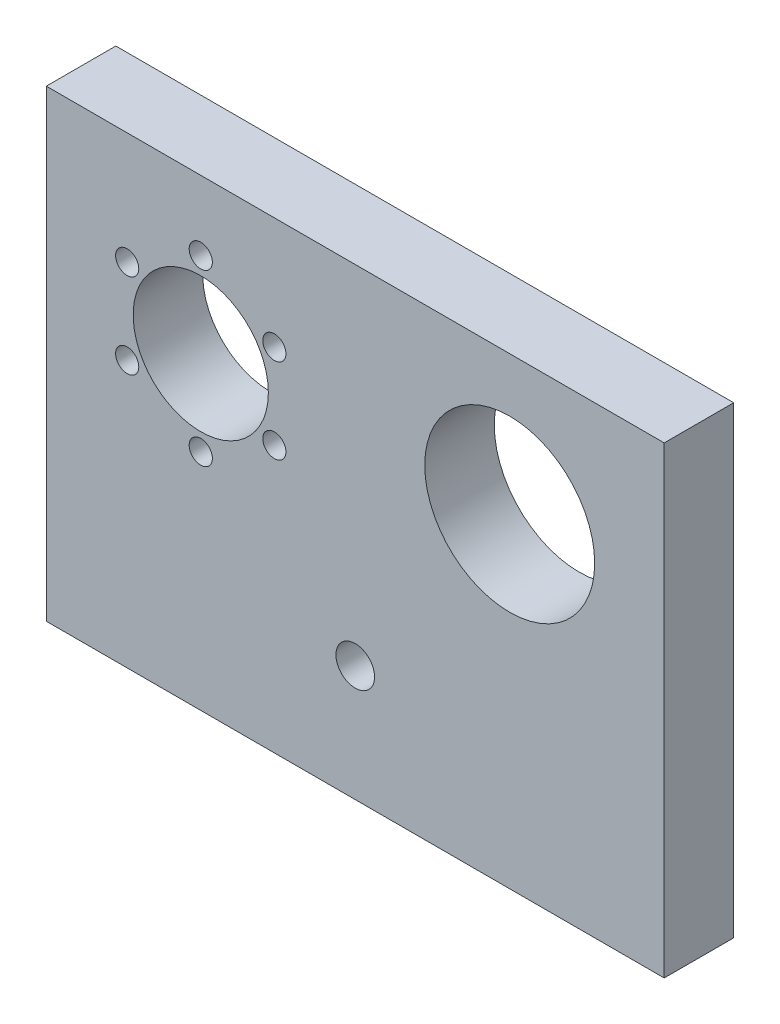
from build123d import *

# Parameters (mm, degrees)
ESQUISSE1_W             = 80
ESQUISSE1_H             = 60
BOSS_EXTRU_1_DEPTH      = 9
ESQUISSE2_R             = 11
ESQUISSE2_R_2           = 8.75
ESQUISSE2_R_3           = 1.5
ENL_V_MAT_EXTRU_1_DEPTH = 101.40418318
ESQUISSE3_R             = 2.5
ENL_V_MAT_EXTRU_2_DEPTH = 101.40418318


with BuildPart() as part:
    # Esquisse1 → Boss.-Extru.1 (new body)
    with BuildSketch(Plane.XY):
        with Locations((40, 30)):
            Rectangle(ESQUISSE1_W, ESQUISSE1_H)
    extrude(amount=BOSS_EXTRU_1_DEPTH)

    # Esquisse2 → Enlèv. mat.-Extru.1 (cut, through all)
    with BuildSketch(Plane.XY.offset(9)):
        with Locations((60, 42)):
            Circle(ESQUISSE2_R)
        with Locations((20, 40)):
            Circle(ESQUISSE2_R_2)
        with Locations((20, 51)):
            Circle(ESQUISSE2_R_3)
        with Locations((29.526279442, 45.5)):
            Circle(ESQUISSE2_R_3)
        with Locations((29.526279442, 34.5)):
            Circle(ESQUISSE2_R_3)
        with Locations((20, 29)):
            Circle(ESQUISSE2_R_3)
        with Locations((10.473720558, 34.5)):
            Circle(ESQUISSE2_R_3)
        with Locations((10.473720558, 45.5)):
            Circle(ESQUISSE2_R_3)
    extrude(amount=-ENL_V_MAT_EXTRU_1_DEPTH, mode=Mode.SUBTRACT)

    # Esquisse3 → Enlèv. mat.-Extru.2 (cut, through all)
    with BuildSketch(Plane.XY.offset(9)):
        with Locations((40, 15)):
            Circle(ESQUISSE3_R)
    extrude(amount=-ENL_V_MAT_EXTRU_2_DEPTH, mode=Mode.SUBTRACT)


solid = part.part
